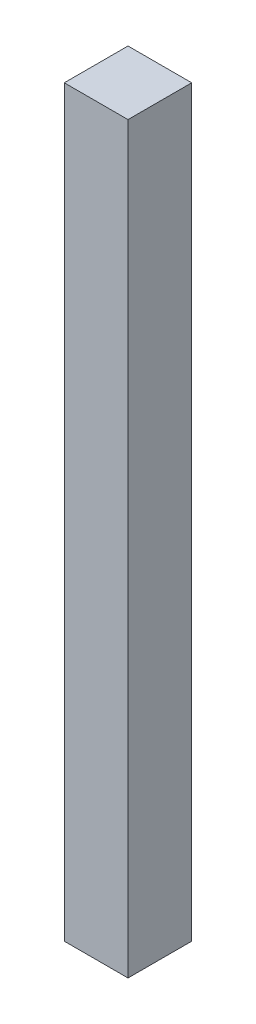
from build123d import *

# Parameters (mm, degrees)
SKETCH1_W           = 19.05
SKETCH1_H           = 19.05
BOSS_EXTRUDE1_DEPTH = 222.25


with BuildPart() as part:
    # Sketch1 → Boss-Extrude1 (new body)
    with BuildSketch(Plane(origin=(0, 0, 0), x_dir=(1, 0, 0), z_dir=(0, 1, 0))):
        Rectangle(SKETCH1_W, SKETCH1_H)
    extrude(amount=BOSS_EXTRUDE1_DEPTH)


solid = part.part
